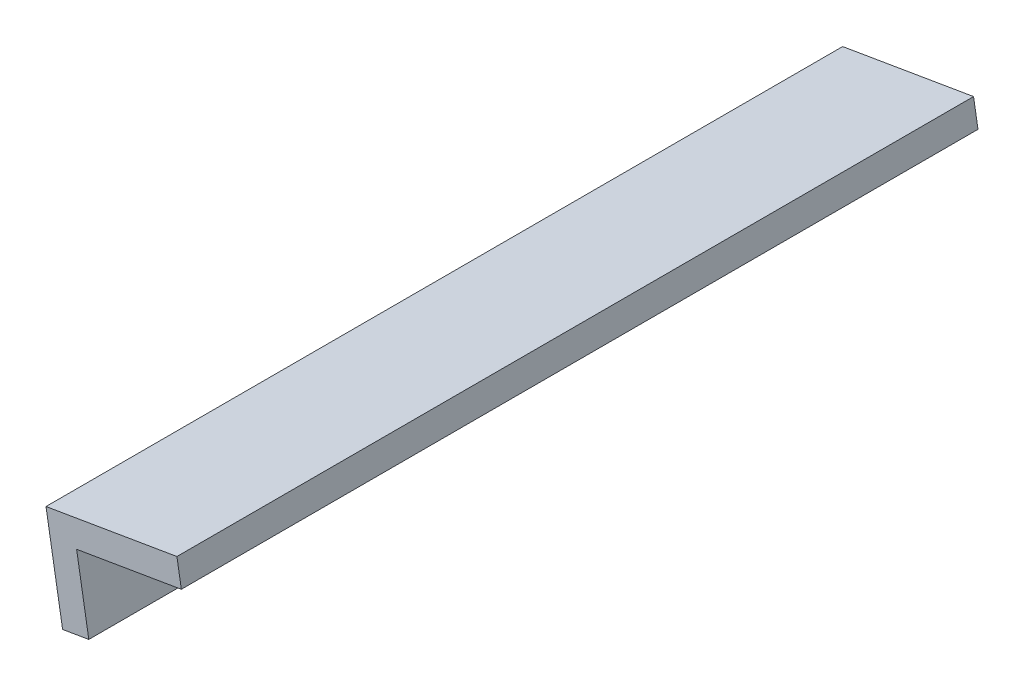
from build123d import *

# Parameters (mm, degrees)
BOSS_EXTRUDE1_DEPTH = 152.4


with BuildPart() as part:
    # Sketch1 → Boss-Extrude1 (new body)
    with BuildSketch(Plane.XY):
        Polygon((-124.766828541, 248.500328159), (-99.722631192, 252.736857298), (-98.875325365, 247.728017828), (-118.910683244, 244.338794517), (-116.580592217, 230.564485975), (-121.589431687, 229.717180147), align=None)
    extrude(amount=-BOSS_EXTRUDE1_DEPTH)


solid = part.part
